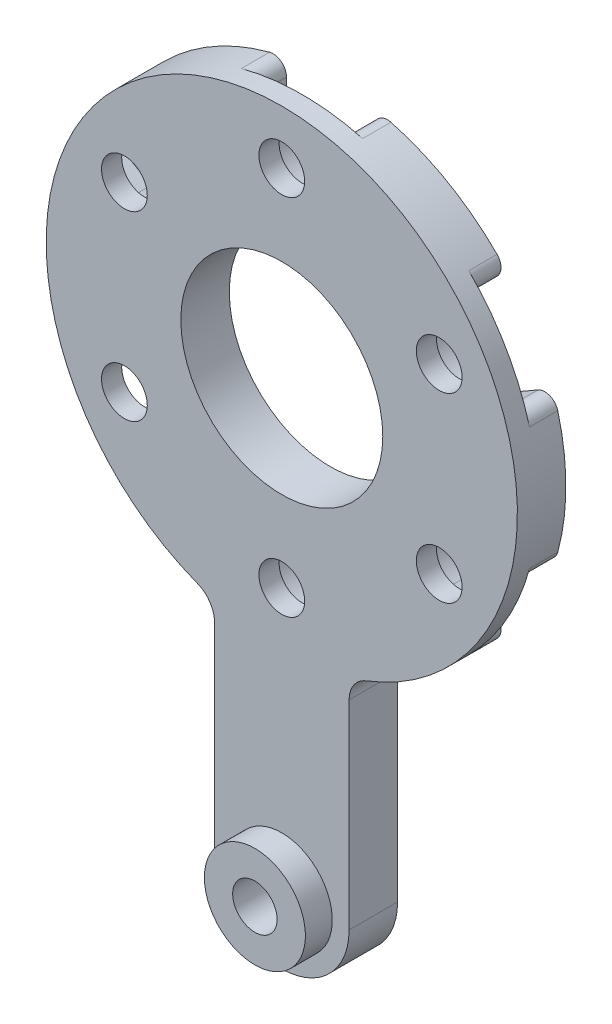
from build123d import *

# Parameters (mm, degrees)
EXTRUDE_1_DEPTH              = 3.6
CUT_EXTRUDE_1_DEPTH          = 2.1
CUT_EXTRUDE_2_DEPTH          = 2.1
CUT_EXTRUDE_3_DEPTH          = 2.1
CUT_EXTRUDE_4_DEPTH          = 2.1
CUT_EXTRUDE_5_DEPTH          = 2.1
SKETCH_7_W                   = 3.75
SKETCH_7_H                   = 2
HOLE_WIZARD_M3_1_D           = 3.3
HOLE_WIZARD_M3_1_CBORE_D     = 6
HOLE_WIZARD_M3_1_CBORE_DEPTH = 0.8
HOLE_WIZARD_3_4_3_4_1_D      = 3.4
HOLE_WIZARD_3_4_3_4_1_DEPTH  = 3.6
HOLE_WIZARD_M3_2_D           = 3.4
HOLE_WIZARD_M3_2_DEPTH       = 5.6
HOLE_WIZARD_M3_2_CBORE_D     = 6.5
HOLE_WIZARD_M3_2_CBORE_DEPTH = 2.1
HOLE_WIZARD_15_0_15_1_D      = 15
FILLET_1_R                   = 2


with BuildPart() as part:
    # 草图1 → 凸台-拉伸1 (new body)
    with BuildSketch(Plane(origin=(0, 0, 0), x_dir=(-1, 0, 0), z_dir=(0, 0, -1))):
        with BuildLine():
            Line((5, 0), (5, 16.229490169))
            ThreePointArc((5, 16.229490169), (0, 50.5), (-5, 16.229490169))
            Line((-5, 16.229490169), (-5, 0))
            ThreePointArc((-5, 0), (0, -5), (5, 0))
        make_face()
    extrude(amount=-EXTRUDE_1_DEPTH)

    # 草图2 → 切除-拉伸1 (cut)
    with BuildSketch(Plane(origin=(0, 0, 0), x_dir=(-1, 0, 0), z_dir=(0, 0, -1))):
        with BuildLine():
            Line((15.432267108, 27.842953181), (13.316342951, 29.064582562))
            ThreePointArc((13.316342951, 29.064582562), (8.876760389, 27.875), (10.066342951, 23.435417438))
            Line((10.066342951, 23.435417438), (12.182267108, 22.213788056))
            ThreePointArc((12.182267108, 22.213788056), (12.673627776, 21.478926775), (12.390283297, 20.641566449))
            ThreePointArc((12.390283297, 20.641566449), (15.155444566, 24.25), (16.897859054, 28.44891668))
            ThreePointArc((16.897859054, 28.44891668), (16.31435598, 27.784853001), (15.432267108, 27.842953181))
        make_face()
    extrude(amount=-CUT_EXTRUDE_1_DEPTH, mode=Mode.SUBTRACT)

    # 草图3 → 切除-拉伸2 (cut)
    with BuildSketch(Plane(origin=(0, 0, 0), x_dir=(-1, 0, 0), z_dir=(0, 0, -1))):
        with BuildLine():
            Line((12.182267108, 43.786211944), (10.066342951, 42.564582562))
            ThreePointArc((10.066342951, 42.564582562), (8.876760389, 38.125), (13.316342951, 36.935417438))
            Line((13.316342951, 36.935417438), (15.432267108, 38.157046819))
            ThreePointArc((15.432267108, 38.157046819), (16.31435598, 38.215146999), (16.897859054, 37.55108332))
            ThreePointArc((16.897859054, 37.55108332), (15.155444566, 41.75), (12.390283297, 45.358433551))
            ThreePointArc((12.390283297, 45.358433551), (12.673627776, 44.521073225), (12.182267108, 43.786211944))
        make_face()
    extrude(amount=-CUT_EXTRUDE_2_DEPTH, mode=Mode.SUBTRACT)

    # 草图4 → 切除-拉伸3 (cut)
    with BuildSketch(Plane(origin=(0, 0, 0), x_dir=(-1, 0, 0), z_dir=(0, 0, -1))):
        with BuildLine():
            Line((-3.25, 48.943258764), (-3.25, 46.5))
            ThreePointArc((-3.25, 46.5), (0, 43.25), (3.25, 46.5))
            Line((3.25, 46.5), (3.25, 48.943258764))
            ThreePointArc((3.25, 48.943258764), (3.640728204, 49.736220225), (4.507575758, 49.90951687))
            ThreePointArc((4.507575758, 49.90951687), (0, 50.5), (-4.507575758, 49.90951687))
            ThreePointArc((-4.507575758, 49.90951687), (-3.640728204, 49.736220225), (-3.25, 48.943258764))
        make_face()
    extrude(amount=-CUT_EXTRUDE_3_DEPTH, mode=Mode.SUBTRACT)

    # 草图5 → 切除-拉伸4 (cut)
    with BuildSketch(Plane(origin=(0, 0, 0), x_dir=(-1, 0, 0), z_dir=(0, 0, -1))):
        with BuildLine():
            Line((-15.432267108, 38.157046819), (-13.316342951, 36.935417438))
            ThreePointArc((-13.316342951, 36.935417438), (-8.876760389, 38.125), (-10.066342951, 42.564582562))
            Line((-10.066342951, 42.564582562), (-12.182267108, 43.786211944))
            ThreePointArc((-12.182267108, 43.786211944), (-12.673627776, 44.521073225), (-12.390283297, 45.358433551))
            ThreePointArc((-12.390283297, 45.358433551), (-15.155444566, 41.75), (-16.897859054, 37.55108332))
            ThreePointArc((-16.897859054, 37.55108332), (-16.31435598, 38.215146999), (-15.432267108, 38.157046819))
        make_face()
    extrude(amount=-CUT_EXTRUDE_4_DEPTH, mode=Mode.SUBTRACT)

    # 草图6 → 切除-拉伸5 (cut)
    with BuildSketch(Plane(origin=(0, 0, 0), x_dir=(-1, 0, 0), z_dir=(0, 0, -1))):
        with BuildLine():
            Line((-12.182267108, 22.213788056), (-10.066342951, 23.435417438))
            ThreePointArc((-10.066342951, 23.435417438), (-8.876760389, 27.875), (-13.316342951, 29.064582562))
            Line((-13.316342951, 29.064582562), (-15.432267108, 27.842953181))
            ThreePointArc((-15.432267108, 27.842953181), (-16.31435598, 27.784853001), (-16.897859054, 28.44891668))
            ThreePointArc((-16.897859054, 28.44891668), (-15.155444566, 24.25), (-12.390283297, 20.641566449))
            ThreePointArc((-12.390283297, 20.641566449), (-12.673627776, 21.478926775), (-12.182267108, 22.213788056))
        make_face()
    extrude(amount=-CUT_EXTRUDE_5_DEPTH, mode=Mode.SUBTRACT)

    # 草图7 → 旋转1 (revolve)
    with BuildSketch(Plane.XZ, mode=Mode.PRIVATE) as revolve_1_sk:
        with Locations((1.875, 4.6)):
            Rectangle(SKETCH_7_W, SKETCH_7_H)
    revolve(revolve_1_sk.sketch.rotate(Axis((0, 0, 5.6), (0, 0, -1)), 180), axis=Axis((0, 0, 5.6), (0, 0, -1)))

    # M3 六角头机械螺钉的柱形沉头孔1 (through all)
    with Locations(Plane(origin=(0, 0, 0), x_dir=(-1, 0, 0), z_dir=(0, 0, -1))):
        with Locations((0, 0)):
            CounterBoreHole(HOLE_WIZARD_M3_1_D / 2, HOLE_WIZARD_M3_1_CBORE_D / 2, HOLE_WIZARD_M3_1_CBORE_DEPTH)

    # Ø3.4 (3.4) 直径孔1
    with Locations(Plane.XY.offset(3.6)):
        with Locations((-11.691342951, 26.25), (-11.691342951, 39.75), (0, 46.5), (11.691342951, 39.75), (11.691342951, 26.25)):
            Hole(HOLE_WIZARD_3_4_3_4_1_D / 2, depth=HOLE_WIZARD_3_4_3_4_1_DEPTH)

    # M3 六角头机械螺钉的柱形沉头孔2
    with Locations(Plane(origin=(0, 0, 0), x_dir=(-1, 0, 0), z_dir=(0, 0, -1))):
        with Locations((0, 19.5)):
            CounterBoreHole(HOLE_WIZARD_M3_2_D / 2, HOLE_WIZARD_M3_2_CBORE_D / 2, HOLE_WIZARD_M3_2_CBORE_DEPTH, depth=HOLE_WIZARD_M3_2_DEPTH)

    # Ø15.0 (15) 直径孔1 (through all)
    with Locations(Plane.XY.offset(3.6)):
        with Locations((0, 33)):
            Hole(HOLE_WIZARD_15_0_15_1_D / 2)

    # 圆角1
    fillet_1_edges = [part.edges().sort_by_distance(p)[0] for p in [
        (5, 16.229490169, 1.8),
        (-5, 16.229490169, 1.8),
    ]]
    fillet(fillet_1_edges, radius=FILLET_1_R)


solid = part.part
